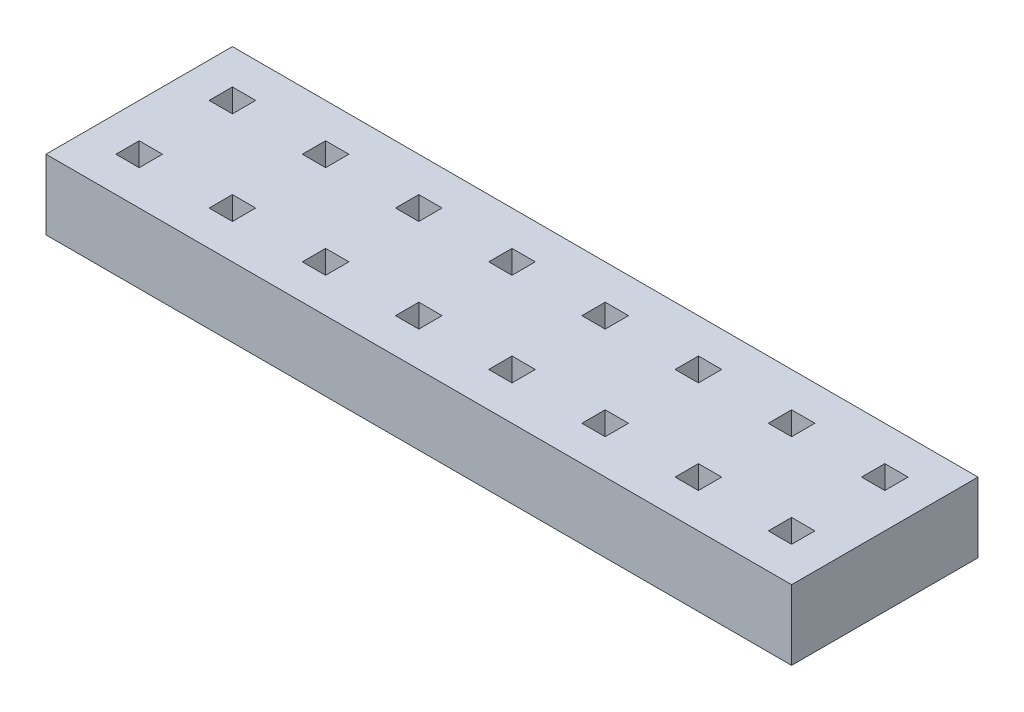
from build123d import *

# Parameters (mm, degrees)
SKETCH1_W           = 16
SKETCH1_H           = 4
BOSS_EXTRUDE1_DEPTH = 1.5
SKETCH2_W           = 0.5
SKETCH2_H           = 0.5
CUT_EXTRUDE1_DEPTH  = 2


with BuildPart() as part:
    # Sketch1 → Boss-Extrude1 (new body)
    with BuildSketch(Plane(origin=(0, 0, 0), x_dir=(1, 0, 0), z_dir=(0, 1, 0))):
        with Locations((8, 2)):
            Rectangle(SKETCH1_W, SKETCH1_H)
    extrude(amount=BOSS_EXTRUDE1_DEPTH)

    # Sketch2 → Cut-Extrude1 (cut)
    with BuildSketch(Plane(origin=(0, 1.5, 0), x_dir=(1, 0, 0), z_dir=(0, 1, 0))):
        with Locations((3, 3)):
            Rectangle(SKETCH2_W, SKETCH2_H)
        with Locations((1, 3)):
            Rectangle(SKETCH2_W, SKETCH2_H)
        with Locations((5, 3)):
            Rectangle(SKETCH2_W, SKETCH2_H)
        with Locations((7, 3)):
            Rectangle(SKETCH2_W, SKETCH2_H)
        with Locations((9, 3)):
            Rectangle(SKETCH2_W, SKETCH2_H)
        with Locations((11, 3)):
            Rectangle(SKETCH2_W, SKETCH2_H)
        with Locations((13, 3)):
            Rectangle(SKETCH2_W, SKETCH2_H)
        with Locations((15, 3)):
            Rectangle(SKETCH2_W, SKETCH2_H)
        with Locations((17, 3)):
            Rectangle(SKETCH2_W, SKETCH2_H)
        with Locations((19, 3)):
            Rectangle(SKETCH2_W, SKETCH2_H)
        with Locations((21, 3)):
            Rectangle(SKETCH2_W, SKETCH2_H)
        with Locations((23, 3)):
            Rectangle(SKETCH2_W, SKETCH2_H)
        with Locations((25, 3)):
            Rectangle(SKETCH2_W, SKETCH2_H)
        with Locations((27, 3)):
            Rectangle(SKETCH2_W, SKETCH2_H)
        with Locations((29, 3)):
            Rectangle(SKETCH2_W, SKETCH2_H)
        with Locations((31, 3)):
            Rectangle(SKETCH2_W, SKETCH2_H)
        with Locations((33, 3)):
            Rectangle(SKETCH2_W, SKETCH2_H)
        with Locations((35, 3)):
            Rectangle(SKETCH2_W, SKETCH2_H)
        with Locations((1, 1)):
            Rectangle(SKETCH2_W, SKETCH2_H)
        with Locations((3, 1)):
            Rectangle(SKETCH2_W, SKETCH2_H)
        with Locations((5, 1)):
            Rectangle(SKETCH2_W, SKETCH2_H)
        with Locations((7, 1)):
            Rectangle(SKETCH2_W, SKETCH2_H)
        with Locations((9, 1)):
            Rectangle(SKETCH2_W, SKETCH2_H)
        with Locations((11, 1)):
            Rectangle(SKETCH2_W, SKETCH2_H)
        with Locations((13, 1)):
            Rectangle(SKETCH2_W, SKETCH2_H)
        with Locations((15, 1)):
            Rectangle(SKETCH2_W, SKETCH2_H)
        with Locations((17, 1)):
            Rectangle(SKETCH2_W, SKETCH2_H)
        with Locations((19, 1)):
            Rectangle(SKETCH2_W, SKETCH2_H)
        with Locations((21, 1)):
            Rectangle(SKETCH2_W, SKETCH2_H)
        with Locations((23, 1)):
            Rectangle(SKETCH2_W, SKETCH2_H)
        with Locations((25, 1)):
            Rectangle(SKETCH2_W, SKETCH2_H)
        with Locations((27, 1)):
            Rectangle(SKETCH2_W, SKETCH2_H)
        with Locations((29, 1)):
            Rectangle(SKETCH2_W, SKETCH2_H)
        with Locations((31, 1)):
            Rectangle(SKETCH2_W, SKETCH2_H)
        with Locations((33, 1)):
            Rectangle(SKETCH2_W, SKETCH2_H)
        with Locations((35, 1)):
            Rectangle(SKETCH2_W, SKETCH2_H)
    extrude(amount=-CUT_EXTRUDE1_DEPTH, mode=Mode.SUBTRACT)


solid = part.part
